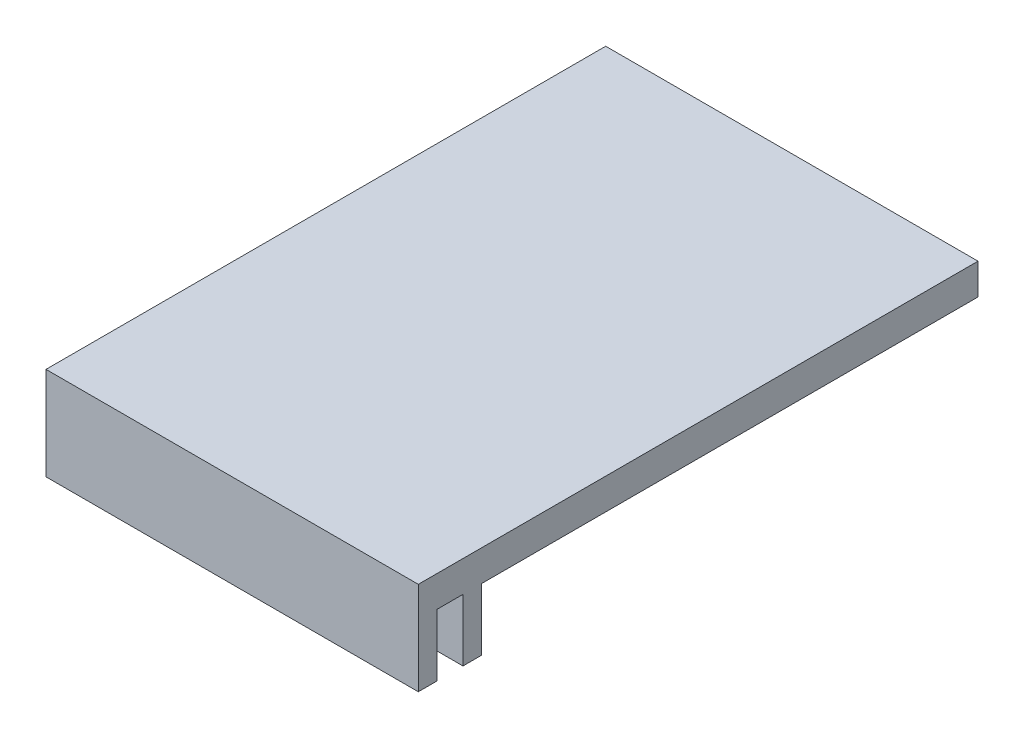
from build123d import *

# Parameters (mm, degrees)
SKETCH1_W                = 20
SKETCH1_H                = 80
BOSS_EXTRUDE1_DEPTH      = 5
BOSS_EXTRUDE2_DEPTH      = 10
BOSS_EXTRUDE2_DEPTH_BACK = 5
SKETCH2_W                = 20
SKETCH2_H                = 10.2
SKETCH3_W                = 20
SKETCH3_H                = 4.2
CUT_EXTRUDE1_DEPTH       = 10
BOSS_EXTRUDE3_DEPTH      = 40


with BuildPart() as part:
    # Sketch1 → Boss-Extrude1 (new body)
    with BuildSketch(Plane(origin=(0, 0, 0), x_dir=(1, 0, 0), z_dir=(0, 1, 0))):
        with Locations((10, 40)):
            Rectangle(SKETCH1_W, SKETCH1_H)
    extrude(amount=BOSS_EXTRUDE1_DEPTH)

    # Sketch2 → Boss-Extrude2 (add, two sides: drawn at the far end of the back side and taken through both)
    with BuildSketch(Plane.XZ.offset(-BOSS_EXTRUDE2_DEPTH_BACK)):
        with Locations((10, 5.1)):
            Rectangle(SKETCH2_W, SKETCH2_H)
    extrude(amount=BOSS_EXTRUDE2_DEPTH + BOSS_EXTRUDE2_DEPTH_BACK)

    # Sketch3 → Cut-Extrude1 (cut)
    with BuildSketch(Plane.XZ.offset(10)):
        with Locations((10, 5.1)):
            Rectangle(SKETCH3_W, SKETCH3_H)
    extrude(amount=-CUT_EXTRUDE1_DEPTH, mode=Mode.SUBTRACT)

    # Sketch5 → Boss-Extrude3 (add)
    with BuildSketch(Plane.ZY):
        Polygon((3, 0), (7.2, 0), (7.2, 5), (-80, 5), (-80, 0), (0, 0), (0, -10), (3, -10), align=None)
        Polygon((7.2, -10), (10.2, -10), (10.2, 5), (7.2, 5), (7.2, 0), align=None)
    extrude(amount=BOSS_EXTRUDE3_DEPTH)


solid = part.part
